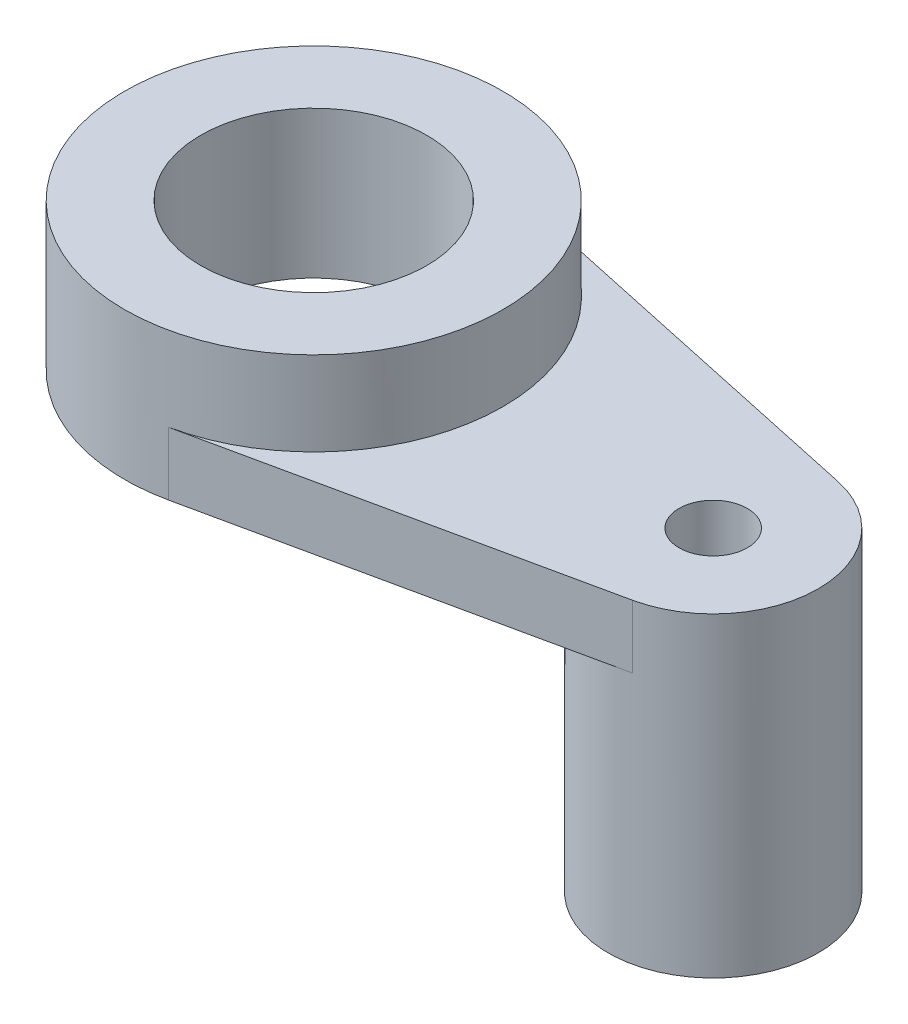
from build123d import *

# Parameters (mm, degrees)
SKETCH1_R           = 10.75
BOSS_EXTRUDE1_DEPTH = 14
BOSS_EXTRUDE2_DEPTH = 6
BOSS_EXTRUDE3_START = 24
SKETCH6_R           = 10
BOSS_EXTRUDE3_DEPTH = 24
SKETCH7_R           = 3.25
CUT_EXTRUDE1_DEPTH  = 64.812224534


with BuildPart() as part:
    # Sketch1 → Boss-Extrude1 (new body)
    with BuildSketch(Plane(origin=(0, 0, 0), x_dir=(1, 0, 0), z_dir=(0, 1, 0))):
        with BuildLine():
            ThreePointArc((18, 0), (14.003758894, 11.309055524), (3.789473684, 17.59658743))
            ThreePointArc((3.789473684, 17.59658743), (-18, 0), (3.789473684, -17.59658743))
            ThreePointArc((3.789473684, -17.59658743), (14.003758894, -11.309055524), (18, 0))
        make_face()
        Circle(SKETCH1_R, mode=Mode.SUBTRACT)
    extrude(amount=BOSS_EXTRUDE1_DEPTH)

    # Sketch1<4> → Boss-Extrude2 (add)
    with BuildSketch(Plane(origin=(0, 0, 0), x_dir=(1, 0, 0), z_dir=(0, 1, 0))):
        with BuildLine():
            ThreePointArc((40.105263158, -9.775881906), (48, 0), (40.105263158, 9.775881906))
            Line((40.105263158, 9.775881906), (3.789473684, 17.59658743))
            ThreePointArc((3.789473684, 17.59658743), (14.003758894, 11.309055524), (18, 0))
            ThreePointArc((18, 0), (14.003758894, -11.309055524), (3.789473684, -17.59658743))
            Line((3.789473684, -17.59658743), (40.105263158, -9.775881906))
        make_face()
    extrude(amount=BOSS_EXTRUDE2_DEPTH)

    # Sketch6 → Boss-Extrude3 (add)
    with BuildSketch(Plane.XZ.offset(BOSS_EXTRUDE3_START)):
        with Locations((38, 0)):
            Circle(SKETCH6_R)
    extrude(amount=-BOSS_EXTRUDE3_DEPTH)

    # Sketch7 → Cut-Extrude1 (cut, through all)
    with BuildSketch(Plane.XZ.offset(24)):
        with Locations((38, 0)):
            Circle(SKETCH7_R)
    extrude(amount=-CUT_EXTRUDE1_DEPTH, mode=Mode.SUBTRACT)


solid = part.part
